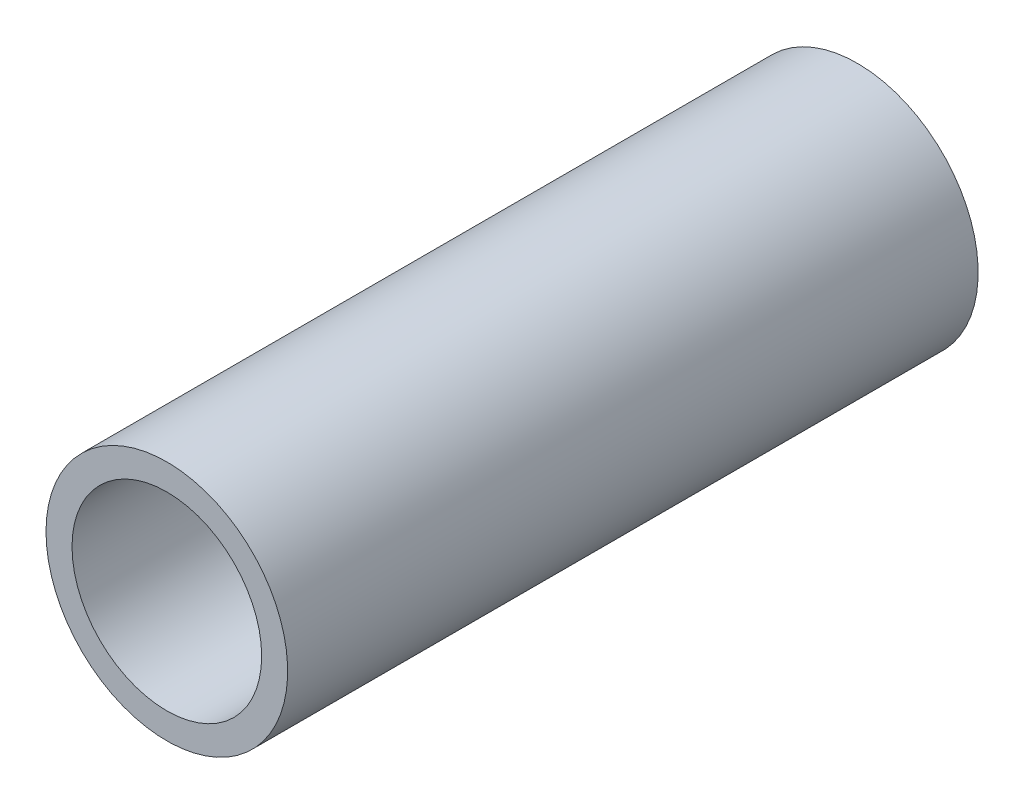
from build123d import *

# Parameters (mm, degrees)
SKETCH1_R           = 13.335
SKETCH1_R_2         = 10.4648
BOSS_EXTRUDE1_DEPTH = 76.2


with BuildPart() as part:
    # Sketch1 → Boss-Extrude1 (new body)
    with BuildSketch(Plane.XY):
        with Locations(Location((0, 0, 0), (0, 0, 180))):
            Circle(SKETCH1_R)
        with Locations(Location((0, 0, 0), (0, 0, 180))):
            Circle(SKETCH1_R_2, mode=Mode.SUBTRACT)
    extrude(amount=BOSS_EXTRUDE1_DEPTH)


solid = part.part
